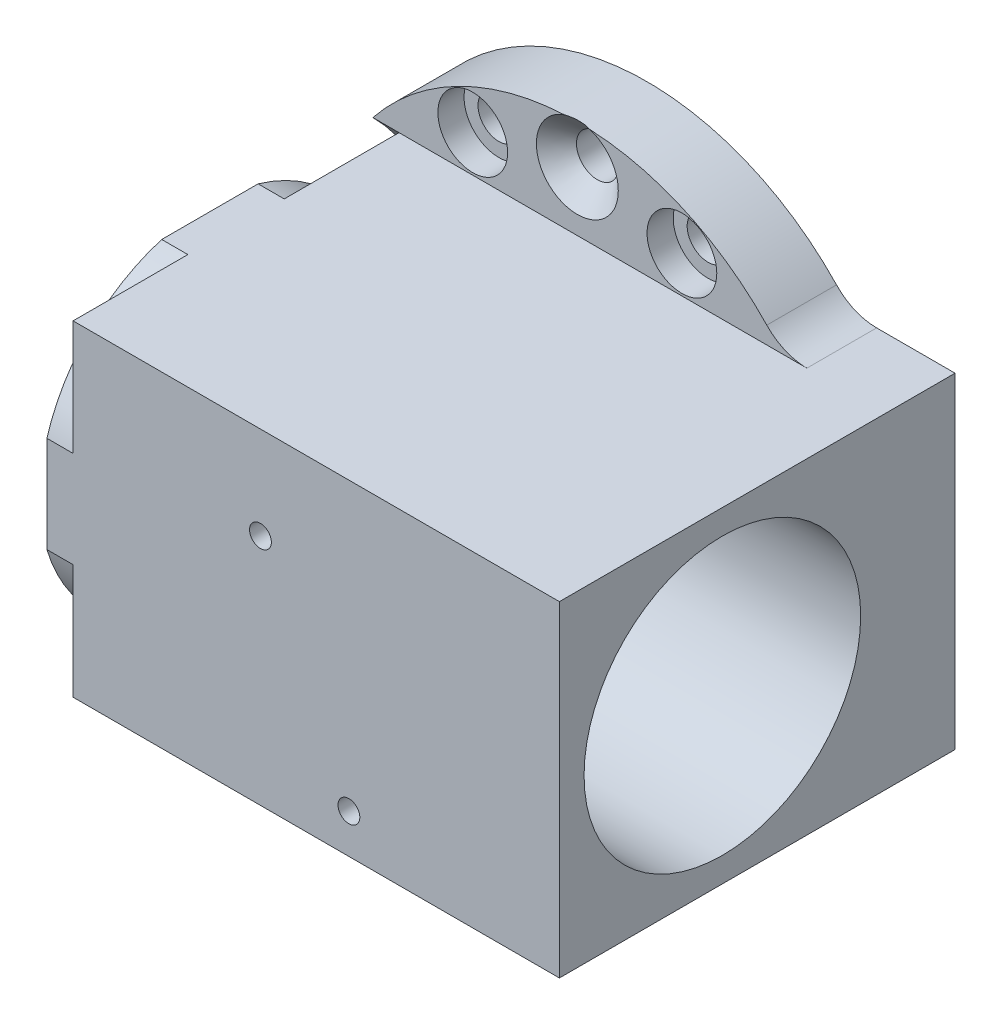
from build123d import *

# Parameters (mm, degrees)
BOSS_EXTRUDE1_DEPTH                             = 8
CUT_EXTRUDE1_REACH                              = 65.856
SKETCH4_W                                       = 55.8
SKETCH4_H                                       = 37.4
BOSS_EXTRUDE2_DEPTH                             = 37.4
BOSS_EXTRUDE3_DEPTH                             = 3
CUT_EXTRUDE2_START                              = -3
CUT_EXTRUDE2_DEPTH                              = 3
CUT_EXTRUDE3_START                              = -3
CUT_EXTRUDE3_DEPTH                              = 3
M4X0_7_TAPPED_HOLE1_D                           = 3.3
M4X0_7_TAPPED_HOLE1_DEPTH                       = 6
M4X0_7_TAPPED_HOLE1_TIP                         = 0.991420021
CSK_FOR_M4_FLAT_HEAD_MACHINE_SCREW1_D           = 4.8
CSK_FOR_M4_FLAT_HEAD_MACHINE_SCREW1_CSINK_D     = 9.4
CSK_FOR_M4_FLAT_HEAD_MACHINE_SCREW1_CSINK_ANGLE = 90
CBORE_FOR_M4_SHCS1_D                            = 4.8
CBORE_FOR_M4_SHCS1_CBORE_D                      = 8
CBORE_FOR_M4_SHCS1_CBORE_DEPTH                  = 3
M3X0_5_TAPPED_HOLE1_D                           = 2.5
M3X0_5_TAPPED_HOLE1_DEPTH                       = 4
M3X0_5_TAPPED_HOLE1_TIP                         = 0.751075774
FILLET1_R                                       = 6.35


with BuildPart() as part:
    # Sketch1 → Boss-Extrude1 (new body)
    with BuildSketch(Plane.XY.offset(8)):
        with BuildLine():
            Line((-23.45868709, 18.7), (-23.45868709, -18.7))
            ThreePointArc((-23.45868709, -18.7), (0, -30), (23.45868709, -18.7))
            Line((23.45868709, -18.7), (35.34131291, -18.7))
            Line((35.34131291, -18.7), (35.34131291, 18.7))
            Line((35.34131291, 18.7), (23.45868709, 18.7))
            ThreePointArc((23.45868709, 18.7), (0, 30), (-23.45868709, 18.7))
        make_face()
    extrude(amount=-BOSS_EXTRUDE1_DEPTH)

    # Sketch3 → Cut-Extrude1 (cut, up to next)
    with BuildSketch(Plane(origin=(-20.45868709, 0, 0), x_dir=(0, 0, -1), z_dir=(1, 0, 0)), mode=Mode.PRIVATE) as cut_extrude1_sk1:
        with BuildLine():
            Line((-8, 18.7), (-8, -18.7))
            ThreePointArc((-8, -18.7), (-0.254206384, 0), (-8, 18.7))
        make_face()
    cut_extrude1_tool1 = extrude(cut_extrude1_sk1.sketch, amount=-CUT_EXTRUDE1_REACH, mode=Mode.PRIVATE) & part.part
    add(cut_extrude1_tool1.solids().sort_by_distance((-20.458687, 0, 4.859168))[0], mode=Mode.SUBTRACT)

    # Sketch4 → Boss-Extrude2 (add)
    with BuildSketch(Plane.XY.offset(8)):
        with Locations((7.44131291, 0)):
            Rectangle(SKETCH4_W, SKETCH4_H)
    extrude(amount=BOSS_EXTRUDE2_DEPTH)

    # Sketch5 → Boss-Extrude3 (add)
    with BuildSketch(Plane.ZY.offset(20.45868709)):
        with BuildLine():
            Line((45.4, 18.7), (45.4, -18.7))
            Line((45.4, -18.7), (21.171890016, -18.7))
            ThreePointArc((21.171890016, -18.7), (7.2, 0), (21.171890016, 18.7))
            Line((21.171890016, 18.7), (45.4, 18.7))
        make_face()
    extrude(amount=BOSS_EXTRUDE3_DEPTH)

    # Sketch6 → Cut-Extrude2 (cut)
    with BuildSketch(Plane.ZY.offset(23.45868709).offset(CUT_EXTRUDE2_START)):
        with BuildLine():
            Line((45.4, -18.7), (45.4, -5.528109984))
            ThreePointArc((45.4, -5.528109984), (40.488582233, -13.788582233), (32.228109984, -18.7))
            Line((32.228109984, -18.7), (45.4, -18.7))
        make_face()
    extrude(amount=CUT_EXTRUDE2_DEPTH, mode=Mode.SUBTRACT)

    # Sketch7 → Cut-Extrude3 (cut)
    with BuildSketch(Plane.ZY.offset(23.45868709).offset(CUT_EXTRUDE3_START)):
        with BuildLine():
            Line((45.4, 18.7), (32.228109984, 18.7))
            ThreePointArc((32.228109984, 18.7), (40.488582233, 13.788582233), (45.4, 5.528109984))
            Line((45.4, 5.528109984), (45.4, 18.7))
        make_face()
    extrude(amount=CUT_EXTRUDE3_DEPTH, mode=Mode.SUBTRACT)

    # Sketch8 → Cut-Revolve1 (revolve, cut)
    with BuildSketch(Plane.XY.offset(26.7)):
        Polygon((-23.45868709, 15.86865), (-23.45868709, 0), (35.34131291, 0), (35.34131291, 15.86865), (9.94131291, 15.86865), (9.94131291, 13.5), (1.94131291, 13.5), (1.94131291, 15.86865), align=None)
    revolve(axis=Axis((-23.45868709, 0, 26.7), (1, 0, 0)), mode=Mode.SUBTRACT)

    # M4x0.7 Tapped Hole1
    with Locations(Plane(origin=(0, -18.7, 0), x_dir=(-1, 0, 0), z_dir=(0, -1, 0))):
        with Locations((12.45868709, -39.4), (-29.44131291, -39.4), (-29.44131291, -5.9)):
            Hole(M4X0_7_TAPPED_HOLE1_D / 2, depth=M4X0_7_TAPPED_HOLE1_DEPTH)
            with Locations((0, 0, -(M4X0_7_TAPPED_HOLE1_DEPTH + M4X0_7_TAPPED_HOLE1_TIP / 2))):  # 118° drill point
                Cone(0, M4X0_7_TAPPED_HOLE1_D / 2, M4X0_7_TAPPED_HOLE1_TIP, mode=Mode.SUBTRACT)

    # CSK for M4 Flat Head Machine Screw1 (through all)
    with Locations(Plane.XY.offset(8)):
        with Locations((0, -25.5), (0, 25.5)):
            CounterSinkHole(CSK_FOR_M4_FLAT_HEAD_MACHINE_SCREW1_D / 2, CSK_FOR_M4_FLAT_HEAD_MACHINE_SCREW1_CSINK_D / 2, counter_sink_angle=CSK_FOR_M4_FLAT_HEAD_MACHINE_SCREW1_CSINK_ANGLE)

    # CBORE for M4 SHCS1 (through all)
    with Locations(Plane.XY.offset(8)):
        with Locations((-12, -22.95), (12, -22.95), (12, 22.95), (-12, 22.95)):
            CounterBoreHole(CBORE_FOR_M4_SHCS1_D / 2, CBORE_FOR_M4_SHCS1_CBORE_D / 2, CBORE_FOR_M4_SHCS1_CBORE_DEPTH)

    # M3x0.5 Tapped Hole1
    with Locations(Plane.XY.offset(45.4)):
        with Locations((1.04131291, 8.07366885), (11.191713328, -14.199002102)):
            Hole(M3X0_5_TAPPED_HOLE1_D / 2, depth=M3X0_5_TAPPED_HOLE1_DEPTH)
            with Locations((0, 0, -(M3X0_5_TAPPED_HOLE1_DEPTH + M3X0_5_TAPPED_HOLE1_TIP / 2))):  # 118° drill point
                Cone(0, M3X0_5_TAPPED_HOLE1_D / 2, M3X0_5_TAPPED_HOLE1_TIP, mode=Mode.SUBTRACT)

    # Fillet1
    fillet1_edges = [part.edges().sort_by_distance(p)[0] for p in [
        (23.45868709, 18.7, 4),
        (23.45868709, -18.7, 4),
    ]]
    fillet(fillet1_edges, radius=FILLET1_R)


solid = part.part
